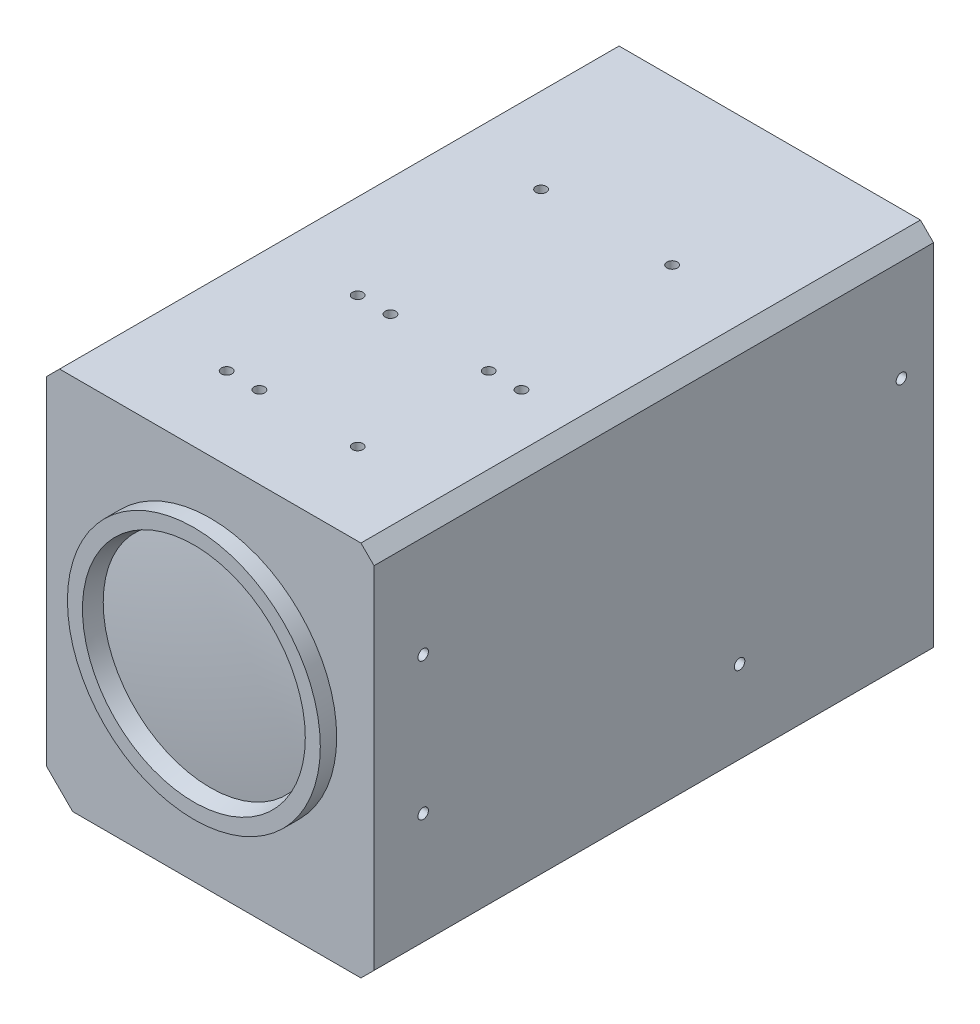
from build123d import *

# Parameters (mm, degrees)
BOSS_EXTRUDE1_DEPTH         = 85.399999968
SKETCH2_R                   = 19.3
SKETCH2_R_2                 = 17.008
BOSS_EXTRUDE2_DEPTH         = 2.5
DRAFT1_ANGLE                = 15
DOME1_FACE_RADIUS           = 16.338127019
DOME1_HEIGHT                = 1
F_1_4_CLEARANCE_HOLE1_D     = 6.7564
F_1_4_CLEARANCE_HOLE1_DEPTH = 8
F_1_4_CLEARANCE_HOLE1_TIP   = 2.029827343
M2X0_4_TAPPED_HOLE1_D       = 1.6
M2X0_4_TAPPED_HOLE1_DEPTH   = 2
M2X0_4_TAPPED_HOLE1_TIP     = 0.480688495
M2X0_4_TAPPED_HOLE2_D       = 1.6
M2X0_4_TAPPED_HOLE2_DEPTH   = 3.2
M2X0_4_TAPPED_HOLE2_TIP     = 0.480688495
M2X0_4_TAPPED_HOLE3_D       = 1.6
M2X0_4_TAPPED_HOLE3_DEPTH   = 3.2
M2X0_4_TAPPED_HOLE3_TIP     = 0.480688495
M2X0_4_TAPPED_HOLE4_D       = 1.6
M2X0_4_TAPPED_HOLE4_DEPTH   = 3.2
M2X0_4_TAPPED_HOLE4_TIP     = 0.480688495


with BuildPart() as part:
    # Sketch1 → Boss-Extrude1 (new body)
    with BuildSketch(Plane.XY):
        Polygon((-25, 25.5), (-23, 27.5), (23, 27.5), (25, 25.5), (25, -28), (23, -30), (-21, -30), (-25, -26), align=None)
    extrude(amount=BOSS_EXTRUDE1_DEPTH)

    # Sketch2 → Boss-Extrude2 (add)
    with BuildSketch(Plane.XY.offset(85.399999968)):
        with Locations(Location((0, 0, 0), (0, 0, 180))):
            Circle(SKETCH2_R)
        Circle(SKETCH2_R_2, mode=Mode.SUBTRACT)
    extrude(amount=BOSS_EXTRUDE2_DEPTH)

    # Draft1
    draft1_faces = [part.faces().sort_by_distance(p)[0] for p in [
        (-17.008, 0, 86.649999968),
    ]]
    draft(draft1_faces, Plane.XY.offset(87.899999968), DRAFT1_ANGLE)

    # Dome1: a dome of height H over a round flat face of radius A is a cap of a sphere of radius (A * A + H * H) / (2 * H)
    dome1_r = (DOME1_FACE_RADIUS * DOME1_FACE_RADIUS + DOME1_HEIGHT * DOME1_HEIGHT) / (2 * DOME1_HEIGHT)
    dome1_base = Plane((0, 0, 85.399999968), z_dir=(0, 0, 1))
    with Locations(dome1_base.offset(DOME1_HEIGHT - dome1_r)):
        dome1_ball = Sphere(dome1_r, mode=Mode.PRIVATE)
    add(split(dome1_ball, bisect_by=dome1_base, keep=Keep.TOP, mode=Mode.PRIVATE))

    # 1/4 Clearance Hole1
    with Locations(Plane.XZ.offset(30)):
        with Locations((0, 67.899999968)):
            Hole(F_1_4_CLEARANCE_HOLE1_D / 2, depth=F_1_4_CLEARANCE_HOLE1_DEPTH)
            with Locations((0, 0, -(F_1_4_CLEARANCE_HOLE1_DEPTH + F_1_4_CLEARANCE_HOLE1_TIP / 2))):  # 118° drill point
                Cone(0, F_1_4_CLEARANCE_HOLE1_D / 2, F_1_4_CLEARANCE_HOLE1_TIP, mode=Mode.SUBTRACT)

    # M2x0.4 Tapped Hole1
    with Locations(Plane(origin=(0, -30, 0), x_dir=(-1, 0, 0), z_dir=(0, -1, 0))):
        with Locations((-8, -51.899999968), (8, -51.899999968), (-8, -22.899999968), (8, -22.899999968), (13.5, -47.699999968), (-13.5, -47.699999968), (-13.5, -14.699999968), (13.5, -14.699999968)):
            Hole(M2X0_4_TAPPED_HOLE1_D / 2, depth=M2X0_4_TAPPED_HOLE1_DEPTH)
            with Locations((0, 0, -(M2X0_4_TAPPED_HOLE1_DEPTH + M2X0_4_TAPPED_HOLE1_TIP / 2))):  # 118° drill point
                Cone(0, M2X0_4_TAPPED_HOLE1_D / 2, M2X0_4_TAPPED_HOLE1_TIP, mode=Mode.SUBTRACT)

    # M2x0.4 Tapped Hole2
    with Locations(Plane(origin=(25, 0, 0), x_dir=(0, 0, -1), z_dir=(1, 0, 0))):
        with Locations((-77.899999968, 10), (-77.899999968, -11), (-4.899999968, 10), (-29.599999968, -15.4)):
            Hole(M2X0_4_TAPPED_HOLE2_D / 2, depth=M2X0_4_TAPPED_HOLE2_DEPTH)
            with Locations((0, 0, -(M2X0_4_TAPPED_HOLE2_DEPTH + M2X0_4_TAPPED_HOLE2_TIP / 2))):  # 118° drill point
                Cone(0, M2X0_4_TAPPED_HOLE2_D / 2, M2X0_4_TAPPED_HOLE2_TIP, mode=Mode.SUBTRACT)

    # M2x0.4 Tapped Hole3
    with Locations(Plane(origin=(0, 27.5, 0), x_dir=(1, 0, 0), z_dir=(0, 1, 0))):
        with Locations((-5, -72.899999968), (15, -52.899999968), (-5, -52.899999968), (-10, -72.899999968), (10, -72.899999968), (10, -52.899999968), (-10, -52.899999968), (-10, -24.899999968), (10, -24.899999968)):
            Hole(M2X0_4_TAPPED_HOLE3_D / 2, depth=M2X0_4_TAPPED_HOLE3_DEPTH)
            with Locations((0, 0, -(M2X0_4_TAPPED_HOLE3_DEPTH + M2X0_4_TAPPED_HOLE3_TIP / 2))):  # 118° drill point
                Cone(0, M2X0_4_TAPPED_HOLE3_D / 2, M2X0_4_TAPPED_HOLE3_TIP, mode=Mode.SUBTRACT)

    # M2x0.4 Tapped Hole4
    with Locations(Plane.ZY.offset(25)):
        with Locations((2.699999968, 4.5), (2.699999968, -9.5)):
            Hole(M2X0_4_TAPPED_HOLE4_D / 2, depth=M2X0_4_TAPPED_HOLE4_DEPTH)
            with Locations((0, 0, -(M2X0_4_TAPPED_HOLE4_DEPTH + M2X0_4_TAPPED_HOLE4_TIP / 2))):  # 118° drill point
                Cone(0, M2X0_4_TAPPED_HOLE4_D / 2, M2X0_4_TAPPED_HOLE4_TIP, mode=Mode.SUBTRACT)


solid = part.part
